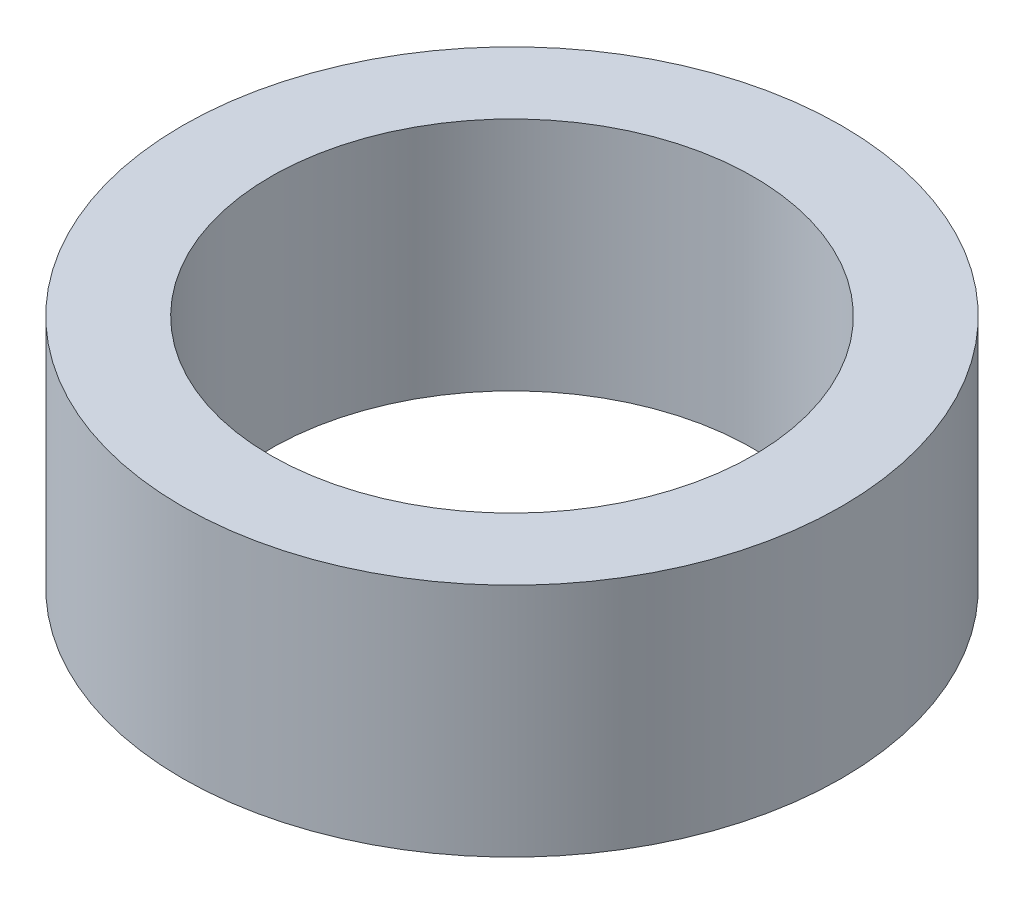
from build123d import *

# Parameters (mm, degrees)
SKIZZE1_R                       = 5.6
SKIZZE1_R_2                     = 4.1
AUFSATZ_LINEAR_AUSTRAGEN1_DEPTH = 4


with BuildPart() as part:
    # Skizze1 → Aufsatz-Linear austragen1 (new body)
    with BuildSketch(Plane(origin=(0, 0, 0), x_dir=(1, 0, 0), z_dir=(0, 1, 0))):
        with Locations(Location((0, 0, 0), (0, 0, 270))):
            Circle(SKIZZE1_R)
        with Locations(Location((0, 0, 0), (0, 0, 270))):
            Circle(SKIZZE1_R_2, mode=Mode.SUBTRACT)
    extrude(amount=AUFSATZ_LINEAR_AUSTRAGEN1_DEPTH)


solid = part.part
